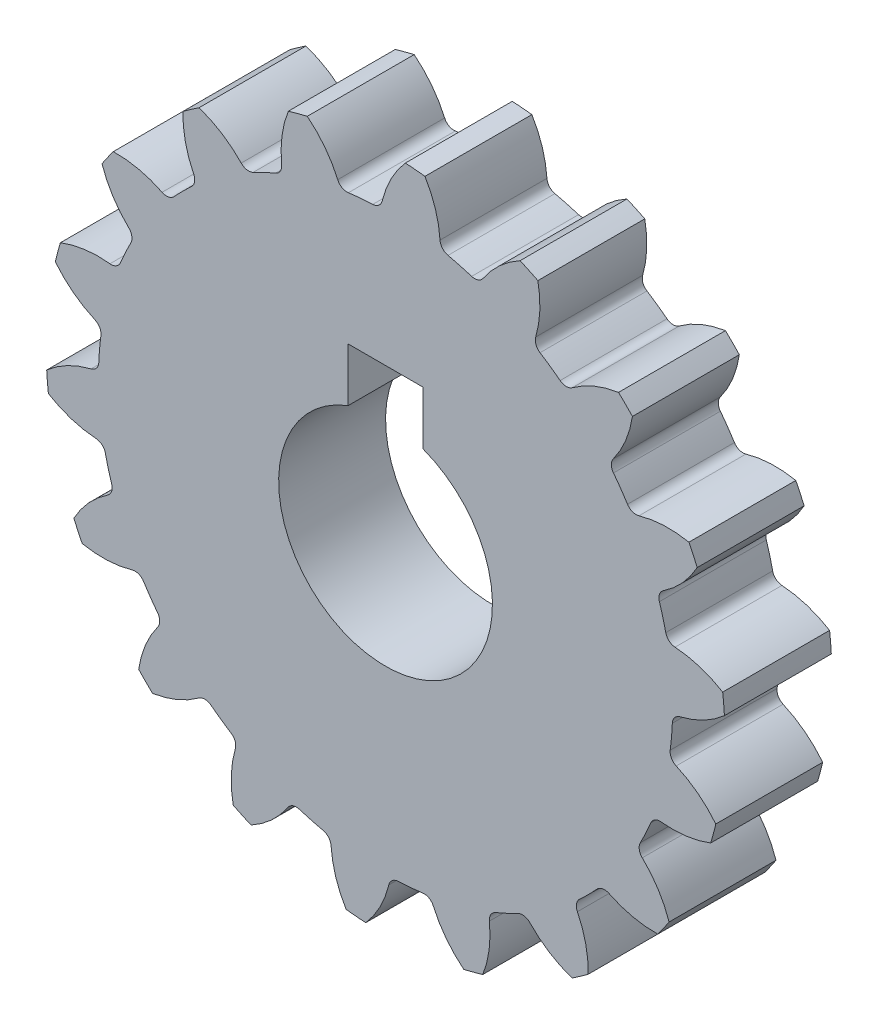
from build123d import *

# Parameters (mm, degrees)
SALIENTE_EXTRUIR1_DEPTH = 10
REDONDEO1_R             = 0.9525
MATRIZC1_COUNT          = 18
REDONDEO1_OF_MATRIZC1_R = 0.9525
CORTAR_EXTRUIR2_REACH   = 47.927


with BuildPart() as part:
    # Croquis2 → Saliente-Extruir1 (new body)
    with BuildSketch(Plane.XY):
        with BuildLine():
            ThreePointArc((-0.45495261, 26.847862198), (-2.343254323, -26.749277479), (5.115982765, 26.35984459))
            ThreePointArc((5.115982765, 26.35984459), (4.763362732, 29.04771461), (3.685950731, 31.535317776))
            ThreePointArc((3.685950731, 31.535317776), (2.770710184, 31.628873914), (1.853143216, 31.695872921))
            ThreePointArc((1.853143216, 31.695872921), (0.359628832, 29.433484599), (-0.45495261, 26.847862198))
        make_face()
    saliente_extruir1 = extrude(amount=SALIENTE_EXTRUIR1_DEPTH)

    # Redondeo1
    redondeo1_edges = [part.edges().sort_by_distance(p)[0] for p in [
        (5.115982765, 26.35984459, 5),
        (-0.45495261, 26.847862198, 5),
    ]]
    fillet(redondeo1_edges, radius=REDONDEO1_R)

    # MatrizC1: Saliente-Extruir1 ×18 about axis
    matrizc1_axis = Axis((0, 0, 0), (0, 0, 1))
    for i in range(1, MATRIZC1_COUNT):
        add(saliente_extruir1.rotate(matrizc1_axis, i * 360 / MATRIZC1_COUNT))

    # Redondeo1 of MatrizC1
    redondeo1_of_matrizc1_edges = [part.edges().sort_by_distance(p)[0] for p in [
        (-4.208146573, 26.519920605, 5),
        (-9.610025287, 25.073135034, 5),
        (-13.024711328, 23.481302802, 5),
        (-17.605987086, 20.274217746, 5),
        (-20.270303672, 17.610493335, 5),
        (-23.478407005, 13.029930581, 5),
        (-25.070998236, 9.615598468, 5),
        (-26.518984536, 4.214041488, 5),
        (-26.847760405, 0.460920514, 5),
        (-26.360981152, -5.110123202, 5),
        (-25.386286437, -8.749351255, 5),
        (-23.023454396, -13.817931616, 5),
        (-20.862851664, -16.904322137, 5),
        (-16.908959249, -20.859093547, 5),
        (-13.823049077, -23.020382288, 5),
        (-8.754994067, -25.384340948, 5),
        (-5.115982765, -26.35984459, 5),
        (0.45495261, -26.847862198, 5),
        (4.208146573, -26.519920605, 5),
        (9.610025287, -25.073135034, 5),
        (13.024711328, -23.481302802, 5),
        (17.605987086, -20.274217746, 5),
        (20.270303672, -17.610493335, 5),
        (23.478407005, -13.029930581, 5),
        (25.070998236, -9.615598468, 5),
        (26.518984536, -4.214041488, 5),
        (26.847760405, -0.460920514, 5),
        (26.360981152, 5.110123202, 5),
        (25.386286437, 8.749351255, 5),
        (23.023454396, 13.817931616, 5),
        (20.862851664, 16.904322137, 5),
        (16.908959249, 20.859093547, 5),
        (13.823049077, 23.020382288, 5),
        (8.754994067, 25.384340948, 5),
    ]]
    fillet(redondeo1_of_matrizc1_edges, radius=REDONDEO1_OF_MATRIZC1_R)

    # Croquis3 → Cortar-Extruir2 (cut, up to next)
    with BuildSketch(Plane.XY.offset(10), mode=Mode.PRIVATE) as cortar_extruir2_sk1:
        with BuildLine():
            Line((-3.5, 14.367496998), (3.5, 14.367496998))
            Line((3.5, 14.367496998), (3.5, 9.367496998))
            ThreePointArc((3.5, 9.367496998), (0, -10), (-3.5, 9.367496998))
            Line((-3.5, 9.367496998), (-3.5, 14.367496998))
        make_face()
    cortar_extruir2_tool1 = extrude(cortar_extruir2_sk1.sketch, amount=-CORTAR_EXTRUIR2_REACH, mode=Mode.PRIVATE) & part.part
    add(cortar_extruir2_tool1.solids().sort_by_distance((0, 1.11725, 10))[0], mode=Mode.SUBTRACT)


solid = part.part
